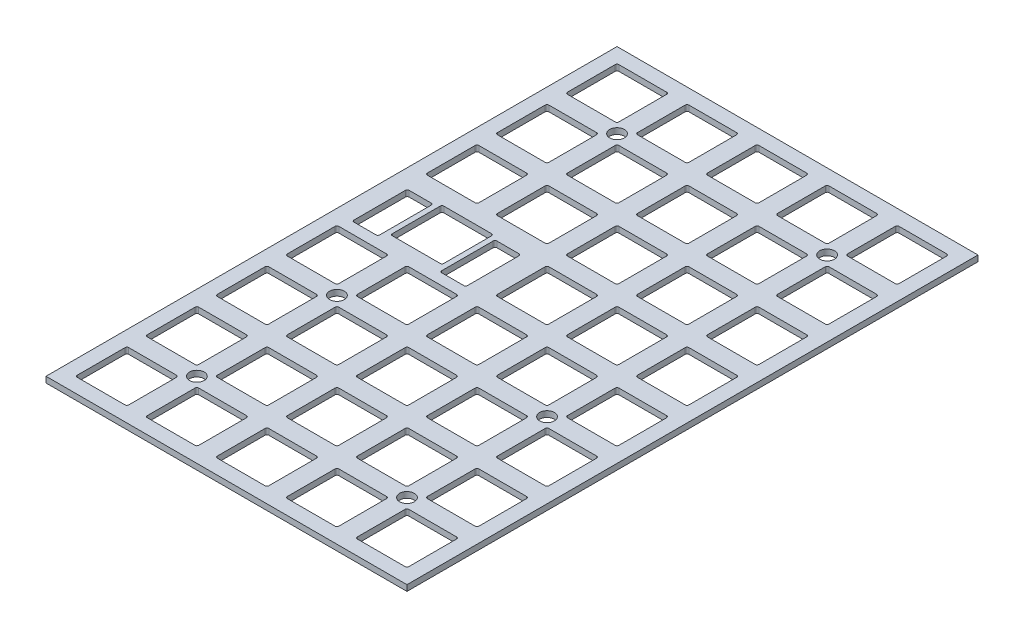
from build123d import *

# Parameters (mm, degrees)
SKETCH3_W           = 98.2
SKETCH3_H           = 155.35
BOSS_EXTRUDE2_DEPTH = 1.6
SKETCH4_R           = 2
CUT_EXTRUDE2_DEPTH  = 181.888038576


with BuildPart() as part:
    # Sketch3 → Boss-Extrude2 (new body)
    with BuildSketch(Plane(origin=(0, 0, 0), x_dir=(1, 0, 0), z_dir=(0, 1, 0))):
        with Locations((-59.9, -66.675)):
            Rectangle(SKETCH3_W, SKETCH3_H)
        with BuildLine():
            Line((-104.500000032, -7), (-91.499999968, -7))
            ThreePointArc((-91.499999968, -7), (-91.1464466, -6.8535534), (-91, -6.500000032))
            Line((-91, -6.500000032), (-91, 6.500000032))
            ThreePointArc((-91, 6.500000032), (-91.1464466, 6.8535534), (-91.499999968, 7))
            Line((-91.499999968, 7), (-104.500000032, 7))
            ThreePointArc((-104.500000032, 7), (-104.8535534, 6.8535534), (-105, 6.500000032))
            Line((-105, 6.500000032), (-105, -6.500000032))
            ThreePointArc((-105, -6.500000032), (-104.8535534, -6.8535534), (-104.500000032, -7))
        make_face(mode=Mode.SUBTRACT)
        with BuildLine():
            Line((-85.450000032, -7), (-72.449999968, -7))
            ThreePointArc((-72.449999968, -7), (-72.0964466, -6.8535534), (-71.95, -6.500000032))
            Line((-71.95, -6.500000032), (-71.95, 6.500000032))
            ThreePointArc((-71.95, 6.500000032), (-72.0964466, 6.8535534), (-72.449999968, 7))
            Line((-72.449999968, 7), (-85.450000032, 7))
            ThreePointArc((-85.450000032, 7), (-85.8035534, 6.8535534), (-85.95, 6.500000032))
            Line((-85.95, 6.500000032), (-85.95, -6.500000032))
            ThreePointArc((-85.95, -6.500000032), (-85.8035534, -6.8535534), (-85.450000032, -7))
        make_face(mode=Mode.SUBTRACT)
        with BuildLine():
            Line((-66.400000032, -7), (-53.399999968, -7))
            ThreePointArc((-53.399999968, -7), (-53.0464466, -6.8535534), (-52.9, -6.500000032))
            Line((-52.9, -6.500000032), (-52.9, 6.500000032))
            ThreePointArc((-52.9, 6.500000032), (-53.0464466, 6.8535534), (-53.399999968, 7))
            Line((-53.399999968, 7), (-66.400000032, 7))
            ThreePointArc((-66.400000032, 7), (-66.7535534, 6.8535534), (-66.9, 6.500000032))
            Line((-66.9, 6.500000032), (-66.9, -6.500000032))
            ThreePointArc((-66.9, -6.500000032), (-66.7535534, -6.8535534), (-66.400000032, -7))
        make_face(mode=Mode.SUBTRACT)
        with BuildLine():
            Line((-47.350000032, -7), (-34.349999968, -7))
            ThreePointArc((-34.349999968, -7), (-33.9964466, -6.8535534), (-33.85, -6.500000032))
            Line((-33.85, -6.500000032), (-33.85, 6.500000032))
            ThreePointArc((-33.85, 6.500000032), (-33.9964466, 6.8535534), (-34.349999968, 7))
            Line((-34.349999968, 7), (-47.350000032, 7))
            ThreePointArc((-47.350000032, 7), (-47.7035534, 6.8535534), (-47.85, 6.500000032))
            Line((-47.85, 6.500000032), (-47.85, -6.500000032))
            ThreePointArc((-47.85, -6.500000032), (-47.7035534, -6.8535534), (-47.350000032, -7))
        make_face(mode=Mode.SUBTRACT)
        with BuildLine():
            Line((-28.300000032, -7), (-15.299999968, -7))
            ThreePointArc((-15.299999968, -7), (-14.9464466, -6.8535534), (-14.8, -6.500000032))
            Line((-14.8, -6.500000032), (-14.8, 6.500000032))
            ThreePointArc((-14.8, 6.500000032), (-14.9464466, 6.8535534), (-15.299999968, 7))
            Line((-15.299999968, 7), (-28.300000032, 7))
            ThreePointArc((-28.300000032, 7), (-28.6535534, 6.8535534), (-28.8, 6.500000032))
            Line((-28.8, 6.500000032), (-28.8, -6.500000032))
            ThreePointArc((-28.8, -6.500000032), (-28.6535534, -6.8535534), (-28.300000032, -7))
        make_face(mode=Mode.SUBTRACT)
        with BuildLine():
            Line((-104.500000032, -26.05), (-91.499999968, -26.05))
            ThreePointArc((-91.499999968, -26.05), (-91.1464466, -25.9035534), (-91, -25.550000032))
            Line((-91, -25.550000032), (-91, -12.549999968))
            ThreePointArc((-91, -12.549999968), (-91.1464466, -12.1964466), (-91.499999968, -12.05))
            Line((-91.499999968, -12.05), (-104.500000032, -12.05))
            ThreePointArc((-104.500000032, -12.05), (-104.8535534, -12.1964466), (-105, -12.549999968))
            Line((-105, -12.549999968), (-105, -25.550000032))
            ThreePointArc((-105, -25.550000032), (-104.8535534, -25.9035534), (-104.500000032, -26.05))
        make_face(mode=Mode.SUBTRACT)
        with BuildLine():
            Line((-85.450000032, -26.05), (-72.449999968, -26.05))
            ThreePointArc((-72.449999968, -26.05), (-72.0964466, -25.9035534), (-71.95, -25.550000032))
            Line((-71.95, -25.550000032), (-71.95, -12.549999968))
            ThreePointArc((-71.95, -12.549999968), (-72.0964466, -12.1964466), (-72.449999968, -12.05))
            Line((-72.449999968, -12.05), (-85.450000032, -12.05))
            ThreePointArc((-85.450000032, -12.05), (-85.8035534, -12.1964466), (-85.95, -12.549999968))
            Line((-85.95, -12.549999968), (-85.95, -25.550000032))
            ThreePointArc((-85.95, -25.550000032), (-85.8035534, -25.9035534), (-85.450000032, -26.05))
        make_face(mode=Mode.SUBTRACT)
        with BuildLine():
            Line((-66.400000032, -26.05), (-53.399999968, -26.05))
            ThreePointArc((-53.399999968, -26.05), (-53.0464466, -25.9035534), (-52.9, -25.550000032))
            Line((-52.9, -25.550000032), (-52.9, -12.549999968))
            ThreePointArc((-52.9, -12.549999968), (-53.0464466, -12.1964466), (-53.399999968, -12.05))
            Line((-53.399999968, -12.05), (-66.400000032, -12.05))
            ThreePointArc((-66.400000032, -12.05), (-66.7535534, -12.1964466), (-66.9, -12.549999968))
            Line((-66.9, -12.549999968), (-66.9, -25.550000032))
            ThreePointArc((-66.9, -25.550000032), (-66.7535534, -25.9035534), (-66.400000032, -26.05))
        make_face(mode=Mode.SUBTRACT)
        with BuildLine():
            Line((-47.350000032, -26.05), (-34.349999968, -26.05))
            ThreePointArc((-34.349999968, -26.05), (-33.9964466, -25.9035534), (-33.85, -25.550000032))
            Line((-33.85, -25.550000032), (-33.85, -12.549999968))
            ThreePointArc((-33.85, -12.549999968), (-33.9964466, -12.1964466), (-34.349999968, -12.05))
            Line((-34.349999968, -12.05), (-47.350000032, -12.05))
            ThreePointArc((-47.350000032, -12.05), (-47.7035534, -12.1964466), (-47.85, -12.549999968))
            Line((-47.85, -12.549999968), (-47.85, -25.550000032))
            ThreePointArc((-47.85, -25.550000032), (-47.7035534, -25.9035534), (-47.350000032, -26.05))
        make_face(mode=Mode.SUBTRACT)
        with BuildLine():
            Line((-28.300000032, -26.05), (-15.299999968, -26.05))
            ThreePointArc((-15.299999968, -26.05), (-14.9464466, -25.9035534), (-14.8, -25.550000032))
            Line((-14.8, -25.550000032), (-14.8, -12.549999968))
            ThreePointArc((-14.8, -12.549999968), (-14.9464466, -12.1964466), (-15.299999968, -12.05))
            Line((-15.299999968, -12.05), (-28.300000032, -12.05))
            ThreePointArc((-28.300000032, -12.05), (-28.6535534, -12.1964466), (-28.8, -12.549999968))
            Line((-28.8, -12.549999968), (-28.8, -25.550000032))
            ThreePointArc((-28.8, -25.550000032), (-28.6535534, -25.9035534), (-28.300000032, -26.05))
        make_face(mode=Mode.SUBTRACT)
        with BuildLine():
            Line((-104.500000032, -45.1), (-91.499999968, -45.1))
            ThreePointArc((-91.499999968, -45.1), (-91.1464466, -44.9535534), (-91, -44.600000032))
            Line((-91, -44.600000032), (-91, -31.599999968))
            ThreePointArc((-91, -31.599999968), (-91.1464466, -31.2464466), (-91.499999968, -31.1))
            Line((-91.499999968, -31.1), (-104.500000032, -31.1))
            ThreePointArc((-104.500000032, -31.1), (-104.8535534, -31.2464466), (-105, -31.599999968))
            Line((-105, -31.599999968), (-105, -44.600000032))
            ThreePointArc((-105, -44.600000032), (-104.8535534, -44.9535534), (-104.500000032, -45.1))
        make_face(mode=Mode.SUBTRACT)
        with BuildLine():
            Line((-85.450000032, -45.1), (-72.449999968, -45.1))
            ThreePointArc((-72.449999968, -45.1), (-72.0964466, -44.9535534), (-71.95, -44.600000032))
            Line((-71.95, -44.600000032), (-71.95, -31.599999968))
            ThreePointArc((-71.95, -31.599999968), (-72.0964466, -31.2464466), (-72.449999968, -31.1))
            Line((-72.449999968, -31.1), (-85.450000032, -31.1))
            ThreePointArc((-85.450000032, -31.1), (-85.8035534, -31.2464466), (-85.95, -31.599999968))
            Line((-85.95, -31.599999968), (-85.95, -44.600000032))
            ThreePointArc((-85.95, -44.600000032), (-85.8035534, -44.9535534), (-85.450000032, -45.1))
        make_face(mode=Mode.SUBTRACT)
        with BuildLine():
            Line((-66.400000032, -45.1), (-53.399999968, -45.1))
            ThreePointArc((-53.399999968, -45.1), (-53.0464466, -44.9535534), (-52.9, -44.600000032))
            Line((-52.9, -44.600000032), (-52.9, -31.599999968))
            ThreePointArc((-52.9, -31.599999968), (-53.0464466, -31.2464466), (-53.399999968, -31.1))
            Line((-53.399999968, -31.1), (-66.400000032, -31.1))
            ThreePointArc((-66.400000032, -31.1), (-66.7535534, -31.2464466), (-66.9, -31.599999968))
            Line((-66.9, -31.599999968), (-66.9, -44.600000032))
            ThreePointArc((-66.9, -44.600000032), (-66.7535534, -44.9535534), (-66.400000032, -45.1))
        make_face(mode=Mode.SUBTRACT)
        with BuildLine():
            Line((-47.350000032, -45.1), (-34.349999968, -45.1))
            ThreePointArc((-34.349999968, -45.1), (-33.9964466, -44.9535534), (-33.85, -44.600000032))
            Line((-33.85, -44.600000032), (-33.85, -31.599999968))
            ThreePointArc((-33.85, -31.599999968), (-33.9964466, -31.2464466), (-34.349999968, -31.1))
            Line((-34.349999968, -31.1), (-47.350000032, -31.1))
            ThreePointArc((-47.350000032, -31.1), (-47.7035534, -31.2464466), (-47.85, -31.599999968))
            Line((-47.85, -31.599999968), (-47.85, -44.600000032))
            ThreePointArc((-47.85, -44.600000032), (-47.7035534, -44.9535534), (-47.350000032, -45.1))
        make_face(mode=Mode.SUBTRACT)
        with BuildLine():
            Line((-28.300000032, -45.1), (-15.299999968, -45.1))
            ThreePointArc((-15.299999968, -45.1), (-14.9464466, -44.9535534), (-14.8, -44.600000032))
            Line((-14.8, -44.600000032), (-14.8, -31.599999968))
            ThreePointArc((-14.8, -31.599999968), (-14.9464466, -31.2464466), (-15.299999968, -31.1))
            Line((-15.299999968, -31.1), (-28.300000032, -31.1))
            ThreePointArc((-28.300000032, -31.1), (-28.6535534, -31.2464466), (-28.8, -31.599999968))
            Line((-28.8, -31.599999968), (-28.8, -44.600000032))
            ThreePointArc((-28.8, -44.600000032), (-28.6535534, -44.9535534), (-28.300000032, -45.1))
        make_face(mode=Mode.SUBTRACT)
        with BuildLine():
            Line((-94.975000032, -64.15), (-81.974999968, -64.15))
            ThreePointArc((-81.974999968, -64.15), (-81.6214466, -64.0035534), (-81.475, -63.650000032))
            Line((-81.475, -63.650000032), (-81.475, -50.649999968))
            ThreePointArc((-81.475, -50.649999968), (-81.6214466, -50.2964466), (-81.974999968, -50.15))
            Line((-81.974999968, -50.15), (-94.975000032, -50.15))
            ThreePointArc((-94.975000032, -50.15), (-95.3285534, -50.2964466), (-95.475, -50.649999968))
            Line((-95.475, -50.649999968), (-95.475, -63.650000032))
            ThreePointArc((-95.475, -63.650000032), (-95.3285534, -64.0035534), (-94.975000032, -64.15))
        make_face(mode=Mode.SUBTRACT)
        with BuildLine():
            Line((-66.400000032, -64.15), (-53.399999968, -64.15))
            ThreePointArc((-53.399999968, -64.15), (-53.0464466, -64.0035534), (-52.9, -63.650000032))
            Line((-52.9, -63.650000032), (-52.9, -50.649999968))
            ThreePointArc((-52.9, -50.649999968), (-53.0464466, -50.2964466), (-53.399999968, -50.15))
            Line((-53.399999968, -50.15), (-66.400000032, -50.15))
            ThreePointArc((-66.400000032, -50.15), (-66.7535534, -50.2964466), (-66.9, -50.649999968))
            Line((-66.9, -50.649999968), (-66.9, -63.650000032))
            ThreePointArc((-66.9, -63.650000032), (-66.7535534, -64.0035534), (-66.400000032, -64.15))
        make_face(mode=Mode.SUBTRACT)
        with BuildLine():
            Line((-47.350000032, -64.15), (-34.349999968, -64.15))
            ThreePointArc((-34.349999968, -64.15), (-33.9964466, -64.0035534), (-33.85, -63.650000032))
            Line((-33.85, -63.650000032), (-33.85, -50.649999968))
            ThreePointArc((-33.85, -50.649999968), (-33.9964466, -50.2964466), (-34.349999968, -50.15))
            Line((-34.349999968, -50.15), (-47.350000032, -50.15))
            ThreePointArc((-47.350000032, -50.15), (-47.7035534, -50.2964466), (-47.85, -50.649999968))
            Line((-47.85, -50.649999968), (-47.85, -63.650000032))
            ThreePointArc((-47.85, -63.650000032), (-47.7035534, -64.0035534), (-47.350000032, -64.15))
        make_face(mode=Mode.SUBTRACT)
        with BuildLine():
            Line((-28.300000032, -64.15), (-15.299999968, -64.15))
            ThreePointArc((-15.299999968, -64.15), (-14.9464466, -64.0035534), (-14.8, -63.650000032))
            Line((-14.8, -63.650000032), (-14.8, -50.649999968))
            ThreePointArc((-14.8, -50.649999968), (-14.9464466, -50.2964466), (-15.299999968, -50.15))
            Line((-15.299999968, -50.15), (-28.300000032, -50.15))
            ThreePointArc((-28.300000032, -50.15), (-28.6535534, -50.2964466), (-28.8, -50.649999968))
            Line((-28.8, -50.649999968), (-28.8, -63.650000032))
            ThreePointArc((-28.8, -63.650000032), (-28.6535534, -64.0035534), (-28.300000032, -64.15))
        make_face(mode=Mode.SUBTRACT)
        with BuildLine():
            Line((-104.500000032, -83.2), (-91.499999968, -83.2))
            ThreePointArc((-91.499999968, -83.2), (-91.1464466, -83.0535534), (-91, -82.700000032))
            Line((-91, -82.700000032), (-91, -69.699999968))
            ThreePointArc((-91, -69.699999968), (-91.1464466, -69.3464466), (-91.499999968, -69.2))
            Line((-91.499999968, -69.2), (-104.500000032, -69.2))
            ThreePointArc((-104.500000032, -69.2), (-104.8535534, -69.3464466), (-105, -69.699999968))
            Line((-105, -69.699999968), (-105, -82.700000032))
            ThreePointArc((-105, -82.700000032), (-104.8535534, -83.0535534), (-104.500000032, -83.2))
        make_face(mode=Mode.SUBTRACT)
        with BuildLine():
            Line((-85.450000032, -83.2), (-72.449999968, -83.2))
            ThreePointArc((-72.449999968, -83.2), (-72.0964466, -83.0535534), (-71.95, -82.700000032))
            Line((-71.95, -82.700000032), (-71.95, -69.699999968))
            ThreePointArc((-71.95, -69.699999968), (-72.0964466, -69.3464466), (-72.449999968, -69.2))
            Line((-72.449999968, -69.2), (-85.450000032, -69.2))
            ThreePointArc((-85.450000032, -69.2), (-85.8035534, -69.3464466), (-85.95, -69.699999968))
            Line((-85.95, -69.699999968), (-85.95, -82.700000032))
            ThreePointArc((-85.95, -82.700000032), (-85.8035534, -83.0535534), (-85.450000032, -83.2))
        make_face(mode=Mode.SUBTRACT)
        with BuildLine():
            Line((-66.400000032, -83.2), (-53.399999968, -83.2))
            ThreePointArc((-53.399999968, -83.2), (-53.0464466, -83.0535534), (-52.9, -82.700000032))
            Line((-52.9, -82.700000032), (-52.9, -69.699999968))
            ThreePointArc((-52.9, -69.699999968), (-53.0464466, -69.3464466), (-53.399999968, -69.2))
            Line((-53.399999968, -69.2), (-66.400000032, -69.2))
            ThreePointArc((-66.400000032, -69.2), (-66.7535534, -69.3464466), (-66.9, -69.699999968))
            Line((-66.9, -69.699999968), (-66.9, -82.700000032))
            ThreePointArc((-66.9, -82.700000032), (-66.7535534, -83.0535534), (-66.400000032, -83.2))
        make_face(mode=Mode.SUBTRACT)
        with BuildLine():
            Line((-47.350000032, -83.2), (-34.349999968, -83.2))
            ThreePointArc((-34.349999968, -83.2), (-33.9964466, -83.0535534), (-33.85, -82.700000032))
            Line((-33.85, -82.700000032), (-33.85, -69.699999968))
            ThreePointArc((-33.85, -69.699999968), (-33.9964466, -69.3464466), (-34.349999968, -69.2))
            Line((-34.349999968, -69.2), (-47.350000032, -69.2))
            ThreePointArc((-47.350000032, -69.2), (-47.7035534, -69.3464466), (-47.85, -69.699999968))
            Line((-47.85, -69.699999968), (-47.85, -82.700000032))
            ThreePointArc((-47.85, -82.700000032), (-47.7035534, -83.0535534), (-47.350000032, -83.2))
        make_face(mode=Mode.SUBTRACT)
        with BuildLine():
            Line((-28.300000032, -83.2), (-15.299999968, -83.2))
            ThreePointArc((-15.299999968, -83.2), (-14.9464466, -83.0535534), (-14.8, -82.700000032))
            Line((-14.8, -82.700000032), (-14.8, -69.699999968))
            ThreePointArc((-14.8, -69.699999968), (-14.9464466, -69.3464466), (-15.299999968, -69.2))
            Line((-15.299999968, -69.2), (-28.300000032, -69.2))
            ThreePointArc((-28.300000032, -69.2), (-28.6535534, -69.3464466), (-28.8, -69.699999968))
            Line((-28.8, -69.699999968), (-28.8, -82.700000032))
            ThreePointArc((-28.8, -82.700000032), (-28.6535534, -83.0535534), (-28.300000032, -83.2))
        make_face(mode=Mode.SUBTRACT)
        with BuildLine():
            Line((-104.500000032, -102.25), (-91.499999968, -102.25))
            ThreePointArc((-91.499999968, -102.25), (-91.1464466, -102.1035534), (-91, -101.750000032))
            Line((-91, -101.750000032), (-91, -88.749999968))
            ThreePointArc((-91, -88.749999968), (-91.1464466, -88.3964466), (-91.499999968, -88.25))
            Line((-91.499999968, -88.25), (-104.500000032, -88.25))
            ThreePointArc((-104.500000032, -88.25), (-104.8535534, -88.3964466), (-105, -88.749999968))
            Line((-105, -88.749999968), (-105, -101.750000032))
            ThreePointArc((-105, -101.750000032), (-104.8535534, -102.1035534), (-104.500000032, -102.25))
        make_face(mode=Mode.SUBTRACT)
        with BuildLine():
            Line((-85.450000032, -102.25), (-72.449999968, -102.25))
            ThreePointArc((-72.449999968, -102.25), (-72.0964466, -102.1035534), (-71.95, -101.750000032))
            Line((-71.95, -101.750000032), (-71.95, -88.749999968))
            ThreePointArc((-71.95, -88.749999968), (-72.0964466, -88.3964466), (-72.449999968, -88.25))
            Line((-72.449999968, -88.25), (-85.450000032, -88.25))
            ThreePointArc((-85.450000032, -88.25), (-85.8035534, -88.3964466), (-85.95, -88.749999968))
            Line((-85.95, -88.749999968), (-85.95, -101.750000032))
            ThreePointArc((-85.95, -101.750000032), (-85.8035534, -102.1035534), (-85.450000032, -102.25))
        make_face(mode=Mode.SUBTRACT)
        with BuildLine():
            Line((-66.400000032, -102.25), (-53.399999968, -102.25))
            ThreePointArc((-53.399999968, -102.25), (-53.0464466, -102.1035534), (-52.9, -101.750000032))
            Line((-52.9, -101.750000032), (-52.9, -88.749999968))
            ThreePointArc((-52.9, -88.749999968), (-53.0464466, -88.3964466), (-53.399999968, -88.25))
            Line((-53.399999968, -88.25), (-66.400000032, -88.25))
            ThreePointArc((-66.400000032, -88.25), (-66.7535534, -88.3964466), (-66.9, -88.749999968))
            Line((-66.9, -88.749999968), (-66.9, -101.750000032))
            ThreePointArc((-66.9, -101.750000032), (-66.7535534, -102.1035534), (-66.400000032, -102.25))
        make_face(mode=Mode.SUBTRACT)
        with BuildLine():
            Line((-47.350000032, -102.25), (-34.349999968, -102.25))
            ThreePointArc((-34.349999968, -102.25), (-33.9964466, -102.1035534), (-33.85, -101.750000032))
            Line((-33.85, -101.750000032), (-33.85, -88.749999968))
            ThreePointArc((-33.85, -88.749999968), (-33.9964466, -88.3964466), (-34.349999968, -88.25))
            Line((-34.349999968, -88.25), (-47.350000032, -88.25))
            ThreePointArc((-47.350000032, -88.25), (-47.7035534, -88.3964466), (-47.85, -88.749999968))
            Line((-47.85, -88.749999968), (-47.85, -101.750000032))
            ThreePointArc((-47.85, -101.750000032), (-47.7035534, -102.1035534), (-47.350000032, -102.25))
        make_face(mode=Mode.SUBTRACT)
        with BuildLine():
            Line((-28.300000032, -102.25), (-15.299999968, -102.25))
            ThreePointArc((-15.299999968, -102.25), (-14.9464466, -102.1035534), (-14.8, -101.750000032))
            Line((-14.8, -101.750000032), (-14.8, -88.749999968))
            ThreePointArc((-14.8, -88.749999968), (-14.9464466, -88.3964466), (-15.299999968, -88.25))
            Line((-15.299999968, -88.25), (-28.300000032, -88.25))
            ThreePointArc((-28.300000032, -88.25), (-28.6535534, -88.3964466), (-28.8, -88.749999968))
            Line((-28.8, -88.749999968), (-28.8, -101.750000032))
            ThreePointArc((-28.8, -101.750000032), (-28.6535534, -102.1035534), (-28.300000032, -102.25))
        make_face(mode=Mode.SUBTRACT)
        with BuildLine():
            Line((-104.500000032, -121.3), (-91.499999968, -121.3))
            ThreePointArc((-91.499999968, -121.3), (-91.1464466, -121.1535534), (-91, -120.800000032))
            Line((-91, -120.800000032), (-91, -107.799999968))
            ThreePointArc((-91, -107.799999968), (-91.1464466, -107.4464466), (-91.499999968, -107.3))
            Line((-91.499999968, -107.3), (-104.500000032, -107.3))
            ThreePointArc((-104.500000032, -107.3), (-104.8535534, -107.4464466), (-105, -107.799999968))
            Line((-105, -107.799999968), (-105, -120.800000032))
            ThreePointArc((-105, -120.800000032), (-104.8535534, -121.1535534), (-104.500000032, -121.3))
        make_face(mode=Mode.SUBTRACT)
        with BuildLine():
            Line((-85.450000032, -121.3), (-72.449999968, -121.3))
            ThreePointArc((-72.449999968, -121.3), (-72.0964466, -121.1535534), (-71.95, -120.800000032))
            Line((-71.95, -120.800000032), (-71.95, -107.799999968))
            ThreePointArc((-71.95, -107.799999968), (-72.0964466, -107.4464466), (-72.449999968, -107.3))
            Line((-72.449999968, -107.3), (-85.450000032, -107.3))
            ThreePointArc((-85.450000032, -107.3), (-85.8035534, -107.4464466), (-85.95, -107.799999968))
            Line((-85.95, -107.799999968), (-85.95, -120.800000032))
            ThreePointArc((-85.95, -120.800000032), (-85.8035534, -121.1535534), (-85.450000032, -121.3))
        make_face(mode=Mode.SUBTRACT)
        with BuildLine():
            Line((-66.400000032, -121.3), (-53.399999968, -121.3))
            ThreePointArc((-53.399999968, -121.3), (-53.0464466, -121.1535534), (-52.9, -120.800000032))
            Line((-52.9, -120.800000032), (-52.9, -107.799999968))
            ThreePointArc((-52.9, -107.799999968), (-53.0464466, -107.4464466), (-53.399999968, -107.3))
            Line((-53.399999968, -107.3), (-66.400000032, -107.3))
            ThreePointArc((-66.400000032, -107.3), (-66.7535534, -107.4464466), (-66.9, -107.799999968))
            Line((-66.9, -107.799999968), (-66.9, -120.800000032))
            ThreePointArc((-66.9, -120.800000032), (-66.7535534, -121.1535534), (-66.400000032, -121.3))
        make_face(mode=Mode.SUBTRACT)
        with BuildLine():
            Line((-47.350000032, -121.3), (-34.349999968, -121.3))
            ThreePointArc((-34.349999968, -121.3), (-33.9964466, -121.1535534), (-33.85, -120.800000032))
            Line((-33.85, -120.800000032), (-33.85, -107.799999968))
            ThreePointArc((-33.85, -107.799999968), (-33.9964466, -107.4464466), (-34.349999968, -107.3))
            Line((-34.349999968, -107.3), (-47.350000032, -107.3))
            ThreePointArc((-47.350000032, -107.3), (-47.7035534, -107.4464466), (-47.85, -107.799999968))
            Line((-47.85, -107.799999968), (-47.85, -120.800000032))
            ThreePointArc((-47.85, -120.800000032), (-47.7035534, -121.1535534), (-47.350000032, -121.3))
        make_face(mode=Mode.SUBTRACT)
        with BuildLine():
            Line((-28.300000032, -121.3), (-15.299999968, -121.3))
            ThreePointArc((-15.299999968, -121.3), (-14.9464466, -121.1535534), (-14.8, -120.800000032))
            Line((-14.8, -120.800000032), (-14.8, -107.799999968))
            ThreePointArc((-14.8, -107.799999968), (-14.9464466, -107.4464466), (-15.299999968, -107.3))
            Line((-15.299999968, -107.3), (-28.300000032, -107.3))
            ThreePointArc((-28.300000032, -107.3), (-28.6535534, -107.4464466), (-28.8, -107.799999968))
            Line((-28.8, -107.799999968), (-28.8, -120.800000032))
            ThreePointArc((-28.8, -120.800000032), (-28.6535534, -121.1535534), (-28.300000032, -121.3))
        make_face(mode=Mode.SUBTRACT)
        with BuildLine():
            Line((-104.500000032, -140.35), (-91.499999968, -140.35))
            ThreePointArc((-91.499999968, -140.35), (-91.1464466, -140.2035534), (-91, -139.850000032))
            Line((-91, -139.850000032), (-91, -126.849999968))
            ThreePointArc((-91, -126.849999968), (-91.1464466, -126.4964466), (-91.499999968, -126.35))
            Line((-91.499999968, -126.35), (-104.500000032, -126.35))
            ThreePointArc((-104.500000032, -126.35), (-104.8535534, -126.4964466), (-105, -126.849999968))
            Line((-105, -126.849999968), (-105, -139.850000032))
            ThreePointArc((-105, -139.850000032), (-104.8535534, -140.2035534), (-104.500000032, -140.35))
        make_face(mode=Mode.SUBTRACT)
        with BuildLine():
            Line((-85.450000032, -140.35), (-72.449999968, -140.35))
            ThreePointArc((-72.449999968, -140.35), (-72.0964466, -140.2035534), (-71.95, -139.850000032))
            Line((-71.95, -139.850000032), (-71.95, -126.849999968))
            ThreePointArc((-71.95, -126.849999968), (-72.0964466, -126.4964466), (-72.449999968, -126.35))
            Line((-72.449999968, -126.35), (-85.450000032, -126.35))
            ThreePointArc((-85.450000032, -126.35), (-85.8035534, -126.4964466), (-85.95, -126.849999968))
            Line((-85.95, -126.849999968), (-85.95, -139.850000032))
            ThreePointArc((-85.95, -139.850000032), (-85.8035534, -140.2035534), (-85.450000032, -140.35))
        make_face(mode=Mode.SUBTRACT)
        with BuildLine():
            Line((-66.400000032, -140.35), (-53.399999968, -140.35))
            ThreePointArc((-53.399999968, -140.35), (-53.0464466, -140.2035534), (-52.9, -139.850000032))
            Line((-52.9, -139.850000032), (-52.9, -126.849999968))
            ThreePointArc((-52.9, -126.849999968), (-53.0464466, -126.4964466), (-53.399999968, -126.35))
            Line((-53.399999968, -126.35), (-66.400000032, -126.35))
            ThreePointArc((-66.400000032, -126.35), (-66.7535534, -126.4964466), (-66.9, -126.849999968))
            Line((-66.9, -126.849999968), (-66.9, -139.850000032))
            ThreePointArc((-66.9, -139.850000032), (-66.7535534, -140.2035534), (-66.400000032, -140.35))
        make_face(mode=Mode.SUBTRACT)
        with BuildLine():
            Line((-47.350000032, -140.35), (-34.349999968, -140.35))
            ThreePointArc((-34.349999968, -140.35), (-33.9964466, -140.2035534), (-33.85, -139.850000032))
            Line((-33.85, -139.850000032), (-33.85, -126.849999968))
            ThreePointArc((-33.85, -126.849999968), (-33.9964466, -126.4964466), (-34.349999968, -126.35))
            Line((-34.349999968, -126.35), (-47.350000032, -126.35))
            ThreePointArc((-47.350000032, -126.35), (-47.7035534, -126.4964466), (-47.85, -126.849999968))
            Line((-47.85, -126.849999968), (-47.85, -139.850000032))
            ThreePointArc((-47.85, -139.850000032), (-47.7035534, -140.2035534), (-47.350000032, -140.35))
        make_face(mode=Mode.SUBTRACT)
        with BuildLine():
            Line((-28.300000032, -140.35), (-15.299999968, -140.35))
            ThreePointArc((-15.299999968, -140.35), (-14.9464466, -140.2035534), (-14.8, -139.850000032))
            Line((-14.8, -139.850000032), (-14.8, -126.849999968))
            ThreePointArc((-14.8, -126.849999968), (-14.9464466, -126.4964466), (-15.299999968, -126.35))
            Line((-15.299999968, -126.35), (-28.300000032, -126.35))
            ThreePointArc((-28.300000032, -126.35), (-28.6535534, -126.4964466), (-28.8, -126.849999968))
            Line((-28.8, -126.849999968), (-28.8, -139.850000032))
            ThreePointArc((-28.8, -139.850000032), (-28.6535534, -140.2035534), (-28.300000032, -140.35))
        make_face(mode=Mode.SUBTRACT)
        with BuildLine():
            Line((-103.413000032, -66.15), (-97.412999968, -66.15))
            ThreePointArc((-97.412999968, -66.15), (-97.0594466, -66.0035534), (-96.913, -65.650000032))
            Line((-96.913, -65.650000032), (-96.913, -51.649999968))
            ThreePointArc((-96.913, -51.649999968), (-97.0594466, -51.2964466), (-97.412999968, -51.15))
            Line((-97.412999968, -51.15), (-103.413000032, -51.15))
            ThreePointArc((-103.413000032, -51.15), (-103.7665534, -51.2964466), (-103.913, -51.649999968))
            Line((-103.913, -51.649999968), (-103.913, -65.650000032))
            ThreePointArc((-103.913, -65.650000032), (-103.7665534, -66.0035534), (-103.413000032, -66.15))
        make_face(mode=Mode.SUBTRACT)
        with BuildLine():
            Line((-79.537000032, -66.15), (-73.536999968, -66.15))
            ThreePointArc((-73.536999968, -66.15), (-73.1834466, -66.0035534), (-73.037, -65.650000032))
            Line((-73.037, -65.650000032), (-73.037, -51.649999968))
            ThreePointArc((-73.037, -51.649999968), (-73.1834466, -51.2964466), (-73.536999968, -51.15))
            Line((-73.536999968, -51.15), (-79.537000032, -51.15))
            ThreePointArc((-79.537000032, -51.15), (-79.8905534, -51.2964466), (-80.037, -51.649999968))
            Line((-80.037, -51.649999968), (-80.037, -65.650000032))
            ThreePointArc((-80.037, -65.650000032), (-79.8905534, -66.0035534), (-79.537000032, -66.15))
        make_face(mode=Mode.SUBTRACT)
    extrude(amount=BOSS_EXTRUDE2_DEPTH)

    # Sketch4 → Cut-Extrude2 (cut, through all)
    with BuildSketch(Plane(origin=(0, 1.6, 0), x_dir=(1, 0, 0), z_dir=(0, 1, 0))):
        with Locations(Location((-88.475, -9.525, 0), (0, 0, 270))):
            Circle(SKETCH4_R)
        with Locations(Location((-31.325, -9.525, 0), (0, 0, 270))):
            Circle(SKETCH4_R)
        with Locations(Location((-88.475, -85.725, 0), (0, 0, 270))):
            Circle(SKETCH4_R)
        with Locations(Location((-31.325, -85.725, 0), (0, 0, 270))):
            Circle(SKETCH4_R)
        with Locations(Location((-88.475, -123.825, 0), (0, 0, 270))):
            Circle(SKETCH4_R)
        with Locations(Location((-31.325, -123.825, 0), (0, 0, 270))):
            Circle(SKETCH4_R)
    extrude(amount=-CUT_EXTRUDE2_DEPTH, mode=Mode.SUBTRACT)


solid = part.part
